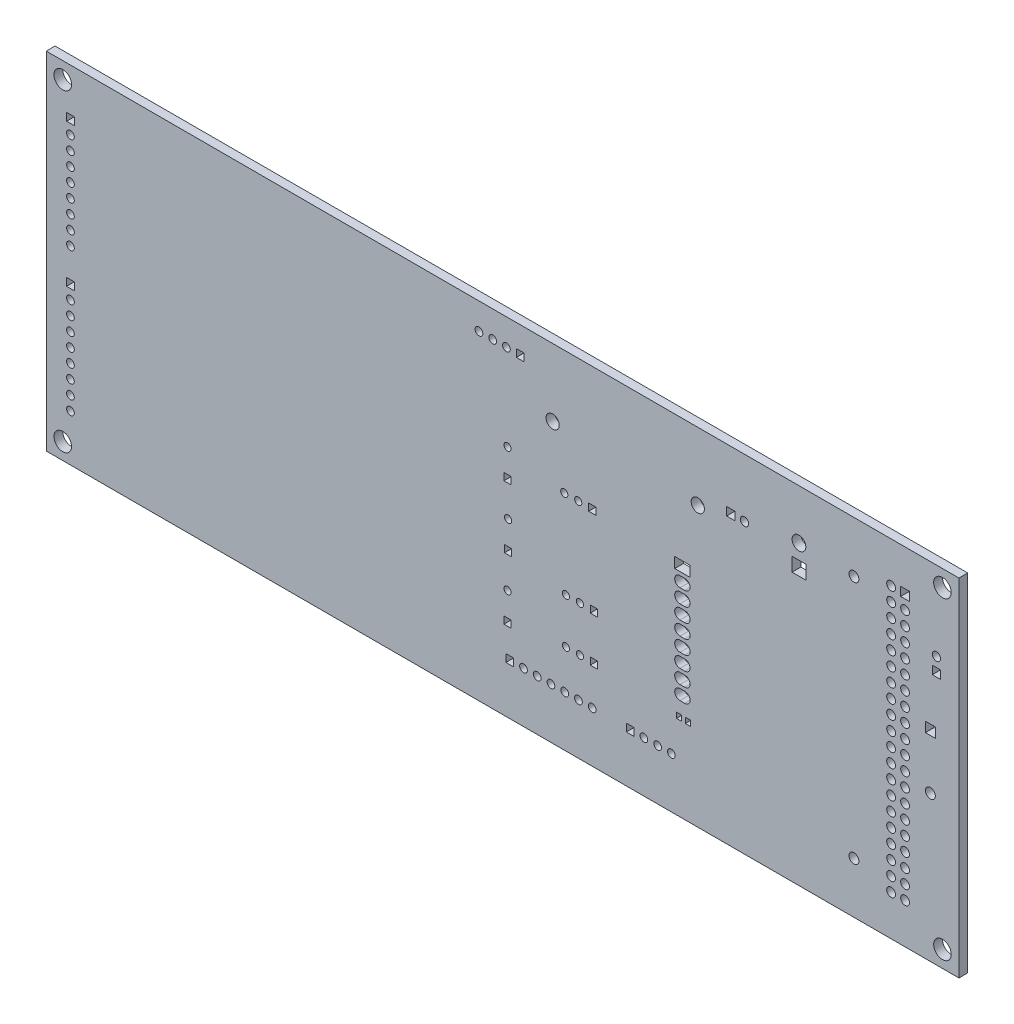
from build123d import *

# Parameters (mm, degrees)
SKETCH1_W           = 166
SKETCH1_H           = 63
SKETCH1_R           = 1.59995
SKETCH1_R_2         = 0.9
SKETCH1_R_3         = 0.7
SKETCH1_R_4         = 0.65
SKETCH1_R_5         = 1.2
SKETCH1_R_6         = 0.75005
SKETCH1_R_7         = 1.25
SKETCH1_R_8         = 0.8
SKETCH1_W_2         = 1.3
SKETCH1_H_2         = 1.3
SKETCH1_W_3         = 1.8
SKETCH1_H_3         = 1.8
SKETCH1_W_4         = 2.794
SKETCH1_H_4         = 1.905
SKETCH1_W_5         = 1.4
SKETCH1_H_5         = 1.4
SKETCH1_W_6         = 1.5001
SKETCH1_H_6         = 1.5001
SKETCH1_W_7         = 2.5
SKETCH1_H_7         = 2.5
SKETCH1_W_8         = 0.95
SKETCH1_H_8         = 1
SKETCH1_W_9         = 1.6
SKETCH1_H_9         = 1.6
BOSS_EXTRUDE1_DEPTH = 1.6


with BuildPart() as part:
    # Sketch1 → Boss-Extrude1 (new body)
    with BuildSketch(Plane.XY):
        with Locations((83, 26.5)):
            Rectangle(SKETCH1_W, SKETCH1_H)
        with Locations((3, -2)):
            Circle(SKETCH1_R, mode=Mode.SUBTRACT)
        with Locations((3, 55)):
            Circle(SKETCH1_R, mode=Mode.SUBTRACT)
        with Locations((163, -2)):
            Circle(SKETCH1_R, mode=Mode.SUBTRACT)
        with Locations((163, 55)):
            Circle(SKETCH1_R, mode=Mode.SUBTRACT)
        with Locations((160.8, 21.5)):
            Circle(SKETCH1_R_2, mode=Mode.SUBTRACT)
        with Locations((4.4, 21)):
            Circle(SKETCH1_R_3, mode=Mode.SUBTRACT)
        with Locations((4.4, 18.5)):
            Circle(SKETCH1_R_3, mode=Mode.SUBTRACT)
        with Locations((4.4, 16)):
            Circle(SKETCH1_R_3, mode=Mode.SUBTRACT)
        with Locations((4.4, 13.5)):
            Circle(SKETCH1_R_3, mode=Mode.SUBTRACT)
        with Locations((4.4, 11)):
            Circle(SKETCH1_R_3, mode=Mode.SUBTRACT)
        with Locations((4.4, 8.5)):
            Circle(SKETCH1_R_3, mode=Mode.SUBTRACT)
        with Locations((4.4, 6)):
            Circle(SKETCH1_R_3, mode=Mode.SUBTRACT)
        with Locations((4.4, 3.5)):
            Circle(SKETCH1_R_3, mode=Mode.SUBTRACT)
        with Locations((4.4, 47)):
            Circle(SKETCH1_R_3, mode=Mode.SUBTRACT)
        with Locations((4.4, 44.5)):
            Circle(SKETCH1_R_3, mode=Mode.SUBTRACT)
        with Locations((4.4, 42)):
            Circle(SKETCH1_R_3, mode=Mode.SUBTRACT)
        with Locations((4.4, 39.5)):
            Circle(SKETCH1_R_3, mode=Mode.SUBTRACT)
        with Locations((4.4, 37)):
            Circle(SKETCH1_R_3, mode=Mode.SUBTRACT)
        with Locations((4.4, 34.5)):
            Circle(SKETCH1_R_3, mode=Mode.SUBTRACT)
        with Locations((4.4, 32)):
            Circle(SKETCH1_R_3, mode=Mode.SUBTRACT)
        with Locations((4.4, 29.5)):
            Circle(SKETCH1_R_3, mode=Mode.SUBTRACT)
        with Locations((97.06, 11.4)):
            Circle(SKETCH1_R_4, mode=Mode.SUBTRACT)
        with Locations((94.52, 11.4)):
            Circle(SKETCH1_R_4, mode=Mode.SUBTRACT)
        with Locations((97.06, 19.6)):
            Circle(SKETCH1_R_4, mode=Mode.SUBTRACT)
        with Locations((94.52, 19.6)):
            Circle(SKETCH1_R_4, mode=Mode.SUBTRACT)
        with Locations((96.76, 35.5)):
            Circle(SKETCH1_R_4, mode=Mode.SUBTRACT)
        with Locations((94.22, 35.5)):
            Circle(SKETCH1_R_4, mode=Mode.SUBTRACT)
        with Locations((92.1, 45.7)):
            Circle(SKETCH1_R_5, mode=Mode.SUBTRACT)
        with Locations((118.5, 45.7)):
            Circle(SKETCH1_R_5, mode=Mode.SUBTRACT)
        with Locations((83.9, 15)):
            Circle(SKETCH1_R_4, mode=Mode.SUBTRACT)
        with Locations((84, 26.3)):
            Circle(SKETCH1_R_4, mode=Mode.SUBTRACT)
        with Locations((83.9, 37.6)):
            Circle(SKETCH1_R_4, mode=Mode.SUBTRACT)
        with Locations((161.9, 43.6)):
            Circle(SKETCH1_R_6, mode=Mode.SUBTRACT)
        with Locations((127, 47.4)):
            Circle(SKETCH1_R_6, mode=Mode.SUBTRACT)
        with Locations((136.9, 48.96)):
            Circle(SKETCH1_R_7, mode=Mode.SUBTRACT)
        with Locations((86.8, 4.2)):
            Circle(SKETCH1_R_3, mode=Mode.SUBTRACT)
        with Locations((89.3, 4.2)):
            Circle(SKETCH1_R_3, mode=Mode.SUBTRACT)
        with Locations((91.8, 4.2)):
            Circle(SKETCH1_R_3, mode=Mode.SUBTRACT)
        with Locations((94.3, 4.2)):
            Circle(SKETCH1_R_3, mode=Mode.SUBTRACT)
        with Locations((96.8, 4.2)):
            Circle(SKETCH1_R_3, mode=Mode.SUBTRACT)
        with Locations((99.3, 4.2)):
            Circle(SKETCH1_R_3, mode=Mode.SUBTRACT)
        with Locations((83.7, 53.2)):
            Circle(SKETCH1_R_3, mode=Mode.SUBTRACT)
        with Locations((81.2, 53.2)):
            Circle(SKETCH1_R_3, mode=Mode.SUBTRACT)
        with Locations((78.7, 53.2)):
            Circle(SKETCH1_R_3, mode=Mode.SUBTRACT)
        with Locations((108.7, 4.2)):
            Circle(SKETCH1_R_3, mode=Mode.SUBTRACT)
        with Locations((111.2, 4.2)):
            Circle(SKETCH1_R_3, mode=Mode.SUBTRACT)
        with Locations((113.7, 4.2)):
            Circle(SKETCH1_R_3, mode=Mode.SUBTRACT)
        with Locations((153.66, 50.6)):
            Circle(SKETCH1_R_8, mode=Mode.SUBTRACT)
        with Locations((156.2, 48.06)):
            Circle(SKETCH1_R_8, mode=Mode.SUBTRACT)
        with Locations((153.66, 48.06)):
            Circle(SKETCH1_R_8, mode=Mode.SUBTRACT)
        with Locations((156.2, 45.52)):
            Circle(SKETCH1_R_8, mode=Mode.SUBTRACT)
        with Locations((153.66, 45.52)):
            Circle(SKETCH1_R_8, mode=Mode.SUBTRACT)
        with Locations((156.2, 42.98)):
            Circle(SKETCH1_R_8, mode=Mode.SUBTRACT)
        with Locations((153.66, 42.98)):
            Circle(SKETCH1_R_8, mode=Mode.SUBTRACT)
        with Locations((156.2, 40.44)):
            Circle(SKETCH1_R_8, mode=Mode.SUBTRACT)
        with Locations((153.66, 40.44)):
            Circle(SKETCH1_R_8, mode=Mode.SUBTRACT)
        with Locations((156.2, 37.9)):
            Circle(SKETCH1_R_8, mode=Mode.SUBTRACT)
        with Locations((153.66, 37.9)):
            Circle(SKETCH1_R_8, mode=Mode.SUBTRACT)
        with Locations((156.2, 35.36)):
            Circle(SKETCH1_R_8, mode=Mode.SUBTRACT)
        with Locations((153.66, 35.36)):
            Circle(SKETCH1_R_8, mode=Mode.SUBTRACT)
        with Locations((156.2, 32.82)):
            Circle(SKETCH1_R_8, mode=Mode.SUBTRACT)
        with Locations((153.66, 32.82)):
            Circle(SKETCH1_R_8, mode=Mode.SUBTRACT)
        with Locations((156.2, 30.28)):
            Circle(SKETCH1_R_8, mode=Mode.SUBTRACT)
        with Locations((153.66, 30.28)):
            Circle(SKETCH1_R_8, mode=Mode.SUBTRACT)
        with Locations((156.2, 27.74)):
            Circle(SKETCH1_R_8, mode=Mode.SUBTRACT)
        with Locations((153.66, 27.74)):
            Circle(SKETCH1_R_8, mode=Mode.SUBTRACT)
        with Locations((156.2, 25.2)):
            Circle(SKETCH1_R_8, mode=Mode.SUBTRACT)
        with Locations((153.66, 25.2)):
            Circle(SKETCH1_R_8, mode=Mode.SUBTRACT)
        with Locations((156.2, 22.66)):
            Circle(SKETCH1_R_8, mode=Mode.SUBTRACT)
        with Locations((153.66, 22.66)):
            Circle(SKETCH1_R_8, mode=Mode.SUBTRACT)
        with Locations((156.2, 20.12)):
            Circle(SKETCH1_R_8, mode=Mode.SUBTRACT)
        with Locations((153.66, 20.12)):
            Circle(SKETCH1_R_8, mode=Mode.SUBTRACT)
        with Locations((156.2, 17.58)):
            Circle(SKETCH1_R_8, mode=Mode.SUBTRACT)
        with Locations((153.66, 17.58)):
            Circle(SKETCH1_R_8, mode=Mode.SUBTRACT)
        with Locations((156.2, 15.04)):
            Circle(SKETCH1_R_8, mode=Mode.SUBTRACT)
        with Locations((153.66, 15.04)):
            Circle(SKETCH1_R_8, mode=Mode.SUBTRACT)
        with Locations((156.2, 12.5)):
            Circle(SKETCH1_R_8, mode=Mode.SUBTRACT)
        with Locations((153.66, 12.5)):
            Circle(SKETCH1_R_8, mode=Mode.SUBTRACT)
        with Locations((156.2, 9.96)):
            Circle(SKETCH1_R_8, mode=Mode.SUBTRACT)
        with Locations((153.66, 9.96)):
            Circle(SKETCH1_R_8, mode=Mode.SUBTRACT)
        with Locations((156.2, 7.42)):
            Circle(SKETCH1_R_8, mode=Mode.SUBTRACT)
        with Locations((153.66, 7.42)):
            Circle(SKETCH1_R_8, mode=Mode.SUBTRACT)
        with Locations((156.2, 4.88)):
            Circle(SKETCH1_R_8, mode=Mode.SUBTRACT)
        with Locations((153.66, 4.88)):
            Circle(SKETCH1_R_8, mode=Mode.SUBTRACT)
        with Locations((156.2, 2.34)):
            Circle(SKETCH1_R_8, mode=Mode.SUBTRACT)
        with Locations((153.66, 2.34)):
            Circle(SKETCH1_R_8, mode=Mode.SUBTRACT)
        with Locations((146.9, 48.7)):
            Circle(SKETCH1_R_2, mode=Mode.SUBTRACT)
        with Locations((146.9, 4.3)):
            Circle(SKETCH1_R_2, mode=Mode.SUBTRACT)
        with Locations((99.6, 19.6)):
            Rectangle(SKETCH1_W_2, SKETCH1_H_2, mode=Mode.SUBTRACT)
        with Locations((160.8, 31.5)):
            Rectangle(SKETCH1_W_3, SKETCH1_H_3, mode=Mode.SUBTRACT)
        with Locations((115.7, 34.6)):
            Rectangle(SKETCH1_W_4, SKETCH1_H_4, mode=Mode.SUBTRACT)
        with BuildLine():
            Line((116.1445, 31.1075), (115.2555, 31.1075))
            ThreePointArc((115.2555, 31.1075), (114.303, 32.06), (115.2555, 33.0125))
            Line((115.2555, 33.0125), (116.1445, 33.0125))
            ThreePointArc((116.1445, 33.0125), (117.097, 32.06), (116.1445, 31.1075))
        make_face(mode=Mode.SUBTRACT)
        with BuildLine():
            Line((116.1445, 28.5675), (115.2555, 28.5675))
            ThreePointArc((115.2555, 28.5675), (114.303, 29.52), (115.2555, 30.4725))
            Line((115.2555, 30.4725), (116.1445, 30.4725))
            ThreePointArc((116.1445, 30.4725), (117.097, 29.52), (116.1445, 28.5675))
        make_face(mode=Mode.SUBTRACT)
        with BuildLine():
            Line((116.1445, 26.0275), (115.2555, 26.0275))
            ThreePointArc((115.2555, 26.0275), (114.303, 26.98), (115.2555, 27.9325))
            Line((115.2555, 27.9325), (116.1445, 27.9325))
            ThreePointArc((116.1445, 27.9325), (117.097, 26.98), (116.1445, 26.0275))
        make_face(mode=Mode.SUBTRACT)
        with BuildLine():
            Line((116.1445, 23.4875), (115.2555, 23.4875))
            ThreePointArc((115.2555, 23.4875), (114.303, 24.44), (115.2555, 25.3925))
            Line((115.2555, 25.3925), (116.1445, 25.3925))
            ThreePointArc((116.1445, 25.3925), (117.097, 24.44), (116.1445, 23.4875))
        make_face(mode=Mode.SUBTRACT)
        with BuildLine():
            Line((116.1445, 20.9475), (115.2555, 20.9475))
            ThreePointArc((115.2555, 20.9475), (114.303, 21.9), (115.2555, 22.8525))
            Line((115.2555, 22.8525), (116.1445, 22.8525))
            ThreePointArc((116.1445, 22.8525), (117.097, 21.9), (116.1445, 20.9475))
        make_face(mode=Mode.SUBTRACT)
        with BuildLine():
            Line((116.1445, 18.4075), (115.2555, 18.4075))
            ThreePointArc((115.2555, 18.4075), (114.303, 19.36), (115.2555, 20.3125))
            Line((115.2555, 20.3125), (116.1445, 20.3125))
            ThreePointArc((116.1445, 20.3125), (117.097, 19.36), (116.1445, 18.4075))
        make_face(mode=Mode.SUBTRACT)
        with BuildLine():
            Line((116.1445, 15.8675), (115.2555, 15.8675))
            ThreePointArc((115.2555, 15.8675), (114.303, 16.82), (115.2555, 17.7725))
            Line((115.2555, 17.7725), (116.1445, 17.7725))
            ThreePointArc((116.1445, 17.7725), (117.097, 16.82), (116.1445, 15.8675))
        make_face(mode=Mode.SUBTRACT)
        with BuildLine():
            Line((116.1445, 13.3275), (115.2555, 13.3275))
            ThreePointArc((115.2555, 13.3275), (114.303, 14.28), (115.2555, 15.2325))
            Line((115.2555, 15.2325), (116.1445, 15.2325))
            ThreePointArc((116.1445, 15.2325), (117.097, 14.28), (116.1445, 13.3275))
        make_face(mode=Mode.SUBTRACT)
        with Locations((4.4, 23.5)):
            Rectangle(SKETCH1_W_5, SKETCH1_H_5, mode=Mode.SUBTRACT)
        with Locations((4.4, 49.5)):
            Rectangle(SKETCH1_W_5, SKETCH1_H_5, mode=Mode.SUBTRACT)
        with Locations((99.6, 11.4)):
            Rectangle(SKETCH1_W_2, SKETCH1_H_2, mode=Mode.SUBTRACT)
        with Locations((99.3, 35.5)):
            Rectangle(SKETCH1_W_2, SKETCH1_H_2, mode=Mode.SUBTRACT)
        with Locations((83.9, 10)):
            Rectangle(SKETCH1_W_2, SKETCH1_H_2, mode=Mode.SUBTRACT)
        with Locations((84, 21.3)):
            Rectangle(SKETCH1_W_2, SKETCH1_H_2, mode=Mode.SUBTRACT)
        with Locations((83.9, 32.6)):
            Rectangle(SKETCH1_W_2, SKETCH1_H_2, mode=Mode.SUBTRACT)
        with Locations((161.9, 41.1)):
            Rectangle(SKETCH1_W_6, SKETCH1_H_6, mode=Mode.SUBTRACT)
        with Locations((124.49995, 47.39995)):
            Rectangle(SKETCH1_W_6, SKETCH1_H_6, mode=Mode.SUBTRACT)
        with Locations((136.9, 45)):
            Rectangle(SKETCH1_W_7, SKETCH1_H_7, mode=Mode.SUBTRACT)
        with Locations((84.3, 4.2)):
            Rectangle(SKETCH1_W_5, SKETCH1_H_5, mode=Mode.SUBTRACT)
        with Locations((86.2, 53.2)):
            Rectangle(SKETCH1_W_5, SKETCH1_H_5, mode=Mode.SUBTRACT)
        with Locations((106.2, 4.2)):
            Rectangle(SKETCH1_W_5, SKETCH1_H_5, mode=Mode.SUBTRACT)
        with Locations((115.1, 10.7)):
            Rectangle(SKETCH1_W_8, SKETCH1_H_8, mode=Mode.SUBTRACT)
        with Locations((116.7, 10.7)):
            Rectangle(SKETCH1_W_8, SKETCH1_H_8, mode=Mode.SUBTRACT)
        with Locations((156.2, 50.6)):
            Rectangle(SKETCH1_W_9, SKETCH1_H_9, mode=Mode.SUBTRACT)
    extrude(amount=BOSS_EXTRUDE1_DEPTH)


solid = part.part
